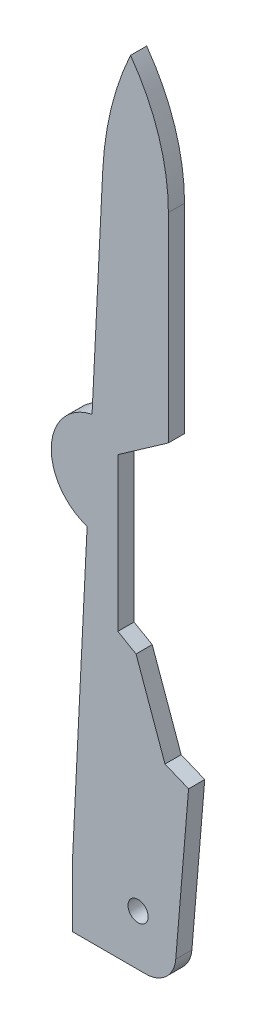
from build123d import *

# Parameters (mm, degrees)
BOSS_EXTRUDE3_DEPTH = 0.8
FILLET2_R           = 3
SKETCH2_R           = 1
CUT_EXTRUDE1_DEPTH  = 79.859431903


with BuildPart() as part:
    # Sketch1 → Boss-Extrude3 (new, symmetric)
    with BuildSketch(Plane.XY):
        with BuildLine():
            ThreePointArc((5.75, 78), (8.53922468, 72.493261963), (9.5, 66.395651864))
            Line((9.5, 66.395651864), (9.5, 46.645651864))
            Line((9.5, 46.645651864), (4.5, 43.144614173))
            Line((4.5, 43.144614173), (4.5, 27.994614173))
            Line((4.5, 27.994614173), (6.3, 26.955383689))
            Line((6.3, 26.955383689), (9.165788003, 18.951905633))
            Line((9.165788003, 18.951905633), (11.5, 17.994614173))
            Line((11.5, 17.994614173), (10, 0))
            Line((10, 0), (0, 0))
            Line((0, 0), (0, 6))
            Line((0, 6), (3.006461475, 66.80874217))
            ThreePointArc((3.006461475, 66.80874217), (3.842195438, 72.535780218), (5.75, 78))
        make_face()
        with BuildLine():
            ThreePointArc((1.944453421, 45.328548769), (-2.087316609, 40.592191664), (1.45758967, 35.481234056))
            Line((1.45758967, 35.481234056), (1.944453421, 45.328548769))
        make_face()
    extrude(amount=BOSS_EXTRUDE3_DEPTH, both=True)

    # Fillet2
    fillet2_edges = [part.edges().sort_by_distance(p)[0] for p in [
        (10, 0, 0),
    ]]
    fillet(fillet2_edges, radius=FILLET2_R)

    # Sketch2 → Cut-Extrude1 (cut, through all)
    with BuildSketch(Plane.XY.offset(0.8)):
        with Locations((6.5, 5.01349848)):
            Circle(SKETCH2_R)
    extrude(amount=-CUT_EXTRUDE1_DEPTH, mode=Mode.SUBTRACT)


solid = part.part
